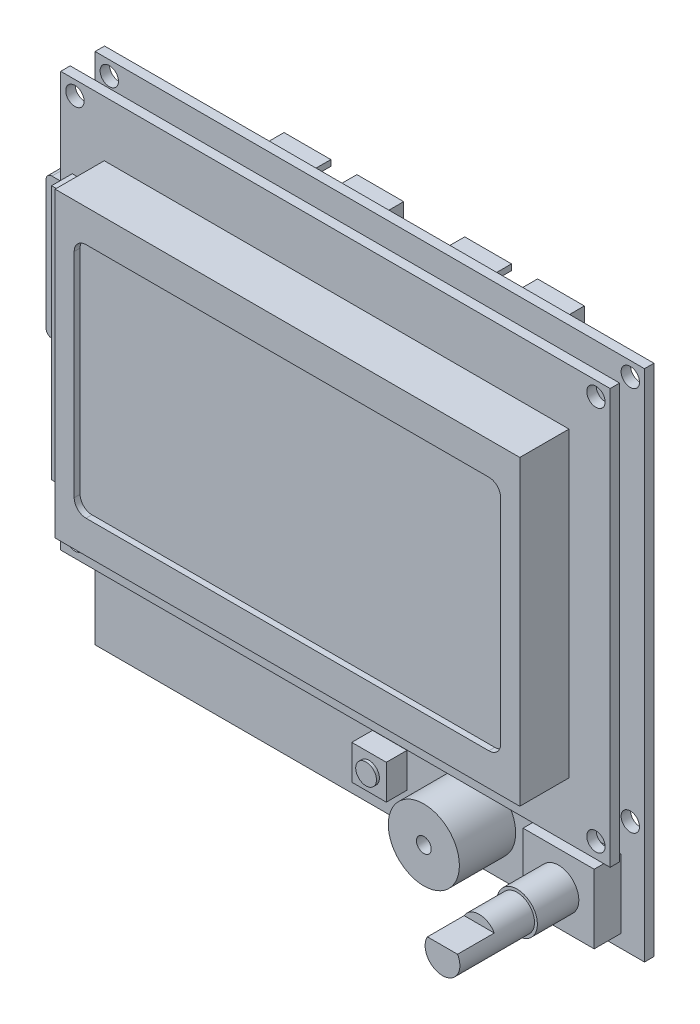
from build123d import *

# Parameters (mm, degrees)
SKETCH1_W                          = 92.75
SKETCH1_H                          = 86.75
SKETCH1_R                          = 1.55
FIRST_PCB_EXTRUDE_DEPTH            = 1.6
SKETCH2_R                          = 6
SPEAKER_EXTRUDE_DEPTH              = 9.5
SKETCH15_R                         = 1.25
SPEAKER_HOLE_CUT_DEPTH             = 5
SKETCH3_W                          = 12
SKETCH3_H                          = 11.65
ROTARY_SWITCH_BASE_EXTRUDE_DEPTH   = 4.5
SKETCH4_W                          = 5.83
SKETCH4_H                          = 5.83
RESET_SWITCH_BASE_EXTRUDE_DEPTH    = 3.5
SKETCH5_R                          = 1.75
RESET_BUTTON_EXTRUDE_DEPTH         = 0.5
SKETCH16_R                         = 3.415
ROTARY_SWITCH_BOTTOM_EXTRUDE_DEPTH = 7
SKETCH17_R                         = 2.935
ROTARY_SWITCH_MIDDLE_EXTRUDE_DEPTH = 6.4
ROTARY_SWITCH_TOP_EXTRUDE_DEPTH    = 6.2
SD_CARD_SLOT_EXTRUDE_DEPTH         = 3
SKETCH19_W                         = 50
SKETCH19_H                         = 2.5
CONNECTOR_EXTRUDE_DEPTH            = 4.2
SKETCH11_W                         = 92.75
SKETCH11_H                         = 70
SKETCH11_R                         = 1.55
UPPER_PCB_EXTRUDE_DEPTH            = 1.6
SKETCH12_W                         = 78.45
SKETCH12_H                         = 51
LCD_EXTRUDE_DEPTH                  = 8.3
SKETCH24_W                         = 5.4
SKETCH24_H                         = 43
LCD_BUMPOUT_EXTRUDE_DEPTH          = 3.5
SCREEN_RECESS_EXTRUDE_DEPTH        = 1
SKETCH21_W                         = 20.2
SKETCH21_H                         = 8.85
SKETCH21_W_2                       = 18.2
SKETCH21_H_2                       = 6.85
CONNECTORS_EXTRUDE_DEPTH           = 9
SKETCH22_W                         = 18.2
SKETCH22_H                         = 6.85
CONNECTOR_RECESS_EXTRUDE_DEPTH     = 2.55
SKETCH23_W                         = 4.4
SKETCH23_H                         = 1
CONNECTOR_NOTCH_EXTRUDE_DEPTH      = 6.45
SKETCH20_W                         = 2.153
SKETCH20_H                         = 23.75
SD_CARD_EXTRUDE_DEPTH              = 10.4
SD_CARD_FILLET_R                   = 1


with BuildPart() as part:
    # Sketch1 → First PCB Extrude (new body)
    with BuildSketch(Plane.XY):
        Rectangle(SKETCH1_W, SKETCH1_H)
        with Locations((-43.975, 40.975)):
            Circle(SKETCH1_R, mode=Mode.SUBTRACT)
        with Locations(Location((43.975, 40.975, 0), (0, 0, 180))):
            Circle(SKETCH1_R, mode=Mode.SUBTRACT)
        with Locations((43.975, -24.025)):
            Circle(SKETCH1_R, mode=Mode.SUBTRACT)
        with Locations(Location((-43.975, -24.025, 0), (0, 0, 180))):
            Circle(SKETCH1_R, mode=Mode.SUBTRACT)
    extrude(amount=FIRST_PCB_EXTRUDE_DEPTH)

    # Sketch2 → Speaker Extrude (add)
    with BuildSketch(Plane.XY.offset(1.6)):
        with Locations(Location((18.625, -35.375, 0), (0, 0, 180))):
            Circle(SKETCH2_R)
    extrude(amount=SPEAKER_EXTRUDE_DEPTH)

    # Sketch15 → Speaker Hole Cut (cut)
    with BuildSketch(Plane.XY.offset(11.1)):
        with Locations((18.625, -35.375)):
            Circle(SKETCH15_R)
    extrude(amount=-SPEAKER_HOLE_CUT_DEPTH, mode=Mode.SUBTRACT)

    # Sketch3 → Rotary Switch Base Extrude (add)
    with BuildSketch(Plane(origin=(0, 0, 1.6), x_dir=(-1, 0, 0), z_dir=(0, 0, 1))):
        with Locations((-36.375, 35.375)):
            Rectangle(SKETCH3_W, SKETCH3_H)
    extrude(amount=ROTARY_SWITCH_BASE_EXTRUDE_DEPTH)

    # Sketch4 → Reset Switch Base Extrude (add)
    with BuildSketch(Plane(origin=(0, 0, 1.6), x_dir=(-1, 0, 0), z_dir=(0, 0, 1))):
        with Locations((-3.375, 35.375)):
            Rectangle(SKETCH4_W, SKETCH4_H)
    extrude(amount=RESET_SWITCH_BASE_EXTRUDE_DEPTH)

    # Sketch5 → Reset Button Extrude (add)
    with BuildSketch(Plane(origin=(0, 0, 5.1), x_dir=(-1, 0, 0), z_dir=(0, 0, 1))):
        with Locations(Location((-3.375, 35.375, 0), (0, 0, 180))):
            Circle(SKETCH5_R)
    extrude(amount=RESET_BUTTON_EXTRUDE_DEPTH)

    # Sketch16 → Rotary Switch Bottom Extrude (add)
    with BuildSketch(Plane.XY.offset(6.1)):
        with Locations((36.375, -35.375)):
            Circle(SKETCH16_R)
    extrude(amount=ROTARY_SWITCH_BOTTOM_EXTRUDE_DEPTH)

    # Sketch17 → Rotary Switch Middle Extrude (add)
    with BuildSketch(Plane.XY.offset(13.1)):
        with Locations((36.375, -35.375)):
            Circle(SKETCH17_R)
    extrude(amount=ROTARY_SWITCH_MIDDLE_EXTRUDE_DEPTH)

    # Sketch18 → Rotary Switch Top Extrude (add)
    with BuildSketch(Plane.XY.offset(19.5)):
        with BuildLine():
            Line((33.831773703, -33.91), (38.918226297, -33.91))
            ThreePointArc((38.918226297, -33.91), (36.375, -38.31), (33.831773703, -33.91))
        make_face()
    extrude(amount=ROTARY_SWITCH_TOP_EXTRUDE_DEPTH)

    # Sketch9 → SD Card Slot Extrude (add)
    with BuildSketch(Plane(origin=(0, 0, 0), x_dir=(1, 0, 0), z_dir=(0, 0, -1))):
        Polygon((-46.125, 5.425), (-27.875, 5.425), (-25.875, 3.425), (-20.375, 3.425), (-20.375, -20.975), (-46.125, -20.975), align=None)
    extrude(amount=SD_CARD_SLOT_EXTRUDE_DEPTH)

    # Sketch19 → Connector Extrude (add)
    with BuildSketch(Plane.XY.offset(1.6)):
        with Locations((-8.375, -24.125)):
            Rectangle(SKETCH19_W, SKETCH19_H)
    extrude(amount=CONNECTOR_EXTRUDE_DEPTH)

    # Sketch11 → Upper PCB Extrude (add)
    with BuildSketch(Plane(origin=(0, -2, 5.8), x_dir=(1, 0, 0), z_dir=(0, 0, -1))):
        with Locations((0, -10.375)):
            Rectangle(SKETCH11_W, SKETCH11_H)
        with Locations((-43.975, -42.975)):
            Circle(SKETCH11_R, mode=Mode.SUBTRACT)
        with Locations(Location((-43.975, 22.025, 0), (0, 0, 180))):
            Circle(SKETCH11_R, mode=Mode.SUBTRACT)
        with Locations(Location((43.975, -42.975, 0), (0, 0, 180))):
            Circle(SKETCH11_R, mode=Mode.SUBTRACT)
        with Locations((43.975, 22.025)):
            Circle(SKETCH11_R, mode=Mode.SUBTRACT)
    extrude(amount=-UPPER_PCB_EXTRUDE_DEPTH)

    # Sketch12 → LCD Extrude (add)
    with BuildSketch(Plane(origin=(0, 0, 7.4), x_dir=(-1, 0, 0), z_dir=(0, 0, 1))):
        with Locations((-0.2, -8.475)):
            Rectangle(SKETCH12_W, SKETCH12_H)
    extrude(amount=LCD_EXTRUDE_DEPTH)

    # Sketch24 → LCD Bumpout Extrude (add)
    with BuildSketch(Plane.XY.offset(7.4)):
        with Locations((-41.725, 7.875)):
            Rectangle(SKETCH24_W, SKETCH24_H)
    extrude(amount=LCD_BUMPOUT_EXTRUDE_DEPTH)

    # Sketch13 → Screen Recess Extrude (cut)
    with BuildSketch(Plane(origin=(0, 0, 15.7), x_dir=(-1, 0, 0), z_dir=(0, 0, 1))):
        with BuildLine():
            Line((-34.2, 11.525), (33.8, 11.525))
            ThreePointArc((33.8, 11.525), (35.214213562, 10.939213562), (35.8, 9.525))
            Line((35.8, 9.525), (35.8, -26.475))
            ThreePointArc((35.8, -26.475), (35.214213562, -27.889213562), (33.8, -28.475))
            Line((33.8, -28.475), (-34.2, -28.475))
            ThreePointArc((-34.2, -28.475), (-35.614213562, -27.889213562), (-36.2, -26.475))
            Line((-36.2, -26.475), (-36.2, 9.525))
            ThreePointArc((-36.2, 9.525), (-35.614213562, 10.939213562), (-34.2, 11.525))
        make_face()
    extrude(amount=-SCREEN_RECESS_EXTRUDE_DEPTH, mode=Mode.SUBTRACT)

    # Sketch21 → Connectors Extrude (add)
    # profile 1 of 2: a face of its own
    with BuildSketch(Plane(origin=(0, 0, 0), x_dir=(-1, 0, 0), z_dir=(0, 0, -1))):
        with Locations((-15.525, 32.45)):
            Rectangle(SKETCH21_W, SKETCH21_H)
        with Locations((-15.525, 32.45)):
            Rectangle(SKETCH21_W_2, SKETCH21_H_2, mode=Mode.SUBTRACT)
    # profile 2 of 2: a face of its own
    with BuildSketch(Plane(origin=(0, 0, 0), x_dir=(-1, 0, 0), z_dir=(0, 0, -1))):
        with Locations((14.975, 32.45)):
            Rectangle(SKETCH21_W, SKETCH21_H)
        with Locations((14.975, 32.45)):
            Rectangle(SKETCH21_W_2, SKETCH21_H_2, mode=Mode.SUBTRACT)
    extrude(amount=CONNECTORS_EXTRUDE_DEPTH)

    # Sketch22 → Connector Recess Extrude (add)
    with BuildSketch(Plane(origin=(0, 0, 0), x_dir=(-1, 0, 0), z_dir=(0, 0, -1))):
        with Locations((-15.525, 32.45)):
            Rectangle(SKETCH22_W, SKETCH22_H)
        with Locations((14.975, 32.45)):
            Rectangle(SKETCH22_W, SKETCH22_H)
    extrude(amount=CONNECTOR_RECESS_EXTRUDE_DEPTH)

    # Sketch23 → Connector Notch Extrude (cut)
    with BuildSketch(Plane(origin=(0, 0, -9), x_dir=(-1, 0, 0), z_dir=(0, 0, -1))):
        with Locations((-15.525, 36.375)):
            Rectangle(SKETCH23_W, SKETCH23_H)
        with Locations((14.975, 36.375)):
            Rectangle(SKETCH23_W, SKETCH23_H)
    extrude(amount=-CONNECTOR_NOTCH_EXTRUDE_DEPTH, mode=Mode.SUBTRACT)

    # Sketch20 → SD Card Extrude (add)
    with BuildSketch(Plane.ZY.offset(46.125)):
        with Locations((-1.3465, 7.775)):
            Rectangle(SKETCH20_W, SKETCH20_H)
    extrude(amount=SD_CARD_EXTRUDE_DEPTH)

    # SD Card Fillet
    sd_card_fillet_edges = [part.edges().sort_by_distance(p)[0] for p in [
        (-56.525, -4.1, -1.3465),
        (-56.525, 19.65, -1.3465),
    ]]
    fillet(sd_card_fillet_edges, radius=SD_CARD_FILLET_R)


solid = part.part
